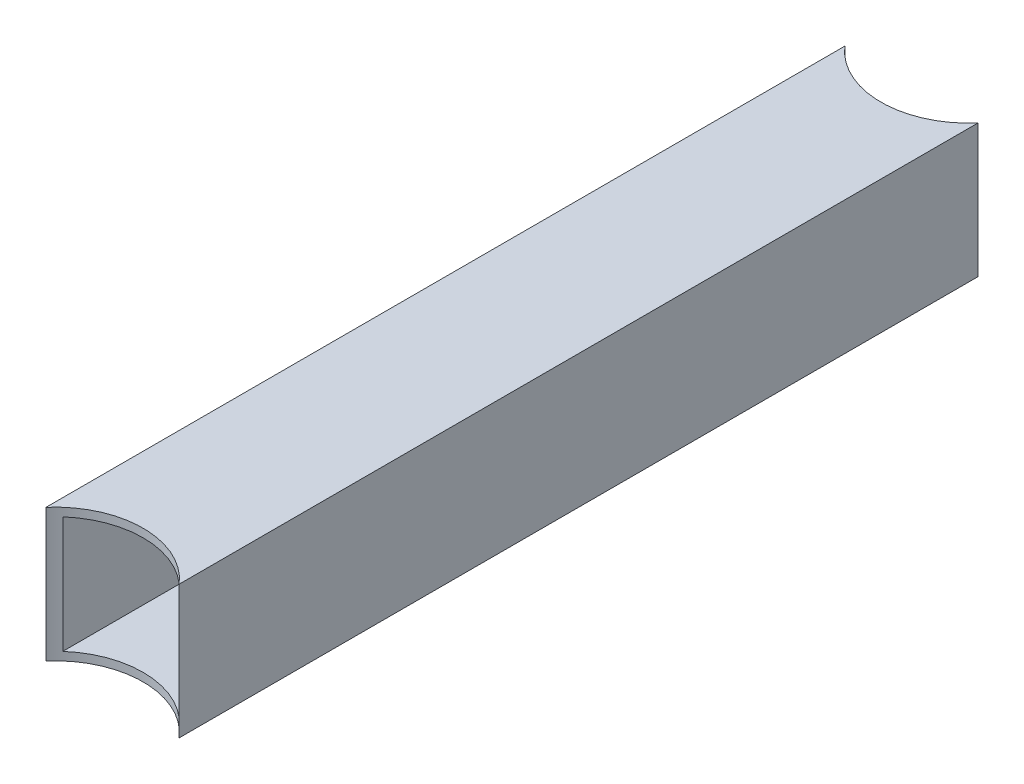
from build123d import *

# Parameters (mm, degrees)
SKETCH1_W           = 25.4
SKETCH1_H           = 25.4
SKETCH1_W_2         = 22.225
SKETCH1_H_2         = 22.225
BOSS_EXTRUDE1_DEPTH = 152.4
CUT_EXTRUDE1_DEPTH  = 156.02325632


with BuildPart() as part:
    # Sketch1 → Boss-Extrude1 (new body)
    with BuildSketch(Plane.XY):
        Rectangle(SKETCH1_W, SKETCH1_H)
        Rectangle(SKETCH1_W_2, SKETCH1_H_2, mode=Mode.SUBTRACT)
    extrude(amount=BOSS_EXTRUDE1_DEPTH)

    # Sketch2 → Cut-Extrude1 (cut, through all)
    with BuildSketch(Plane(origin=(0, 12.7, 0), x_dir=(1, 0, 0), z_dir=(0, 1, 0))):
        with BuildLine():
            Line((-12.7, 0), (12.7, 0))
            ThreePointArc((12.7, 0), (0, -5.821345112), (-12.7, 0))
        make_face()
        with BuildLine():
            Line((12.7, -152.4), (-12.7, -152.4))
            ThreePointArc((-12.7, -152.4), (0, -146.578654888), (12.7, -152.4))
        make_face()
    extrude(amount=-CUT_EXTRUDE1_DEPTH, mode=Mode.SUBTRACT)


solid = part.part
